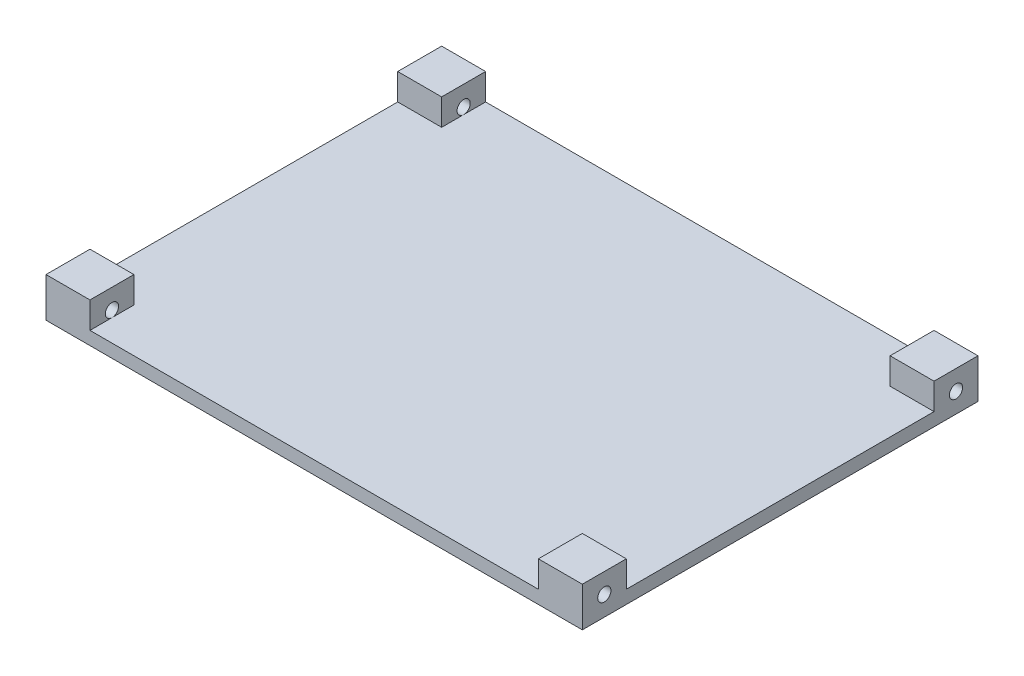
from build123d import *

# Parameters (mm, degrees)
SKETCH1_W           = 122
SKETCH1_H           = 90
BOSS_EXTRUDE1_DEPTH = 3
SKETCH2_W           = 10
SKETCH2_H           = 10
BOSS_EXTRUDE2_DEPTH = 6
CUT_EXTRUDE2_REACH  = 153.872
SKETCH4_R           = 1.5
CUT_EXTRUDE3_REACH  = 153.872
SKETCH5_R           = 1.5


with BuildPart() as part:
    # Sketch1 → Boss-Extrude1 (new body)
    with BuildSketch(Plane(origin=(0, 0, 0), x_dir=(1, 0, 0), z_dir=(0, 1, 0))):
        with Locations((61, 45)):
            Rectangle(SKETCH1_W, SKETCH1_H)
    extrude(amount=BOSS_EXTRUDE1_DEPTH)

    # Sketch2 → Boss-Extrude2 (add)
    with BuildSketch(Plane(origin=(0, 3, 0), x_dir=(1, 0, 0), z_dir=(0, 1, 0))):
        Polygon((0, 0), (10, 0), (10, 5.706645394), (10, 10), (7.781127404, 10), (0, 10), align=None)
        with Locations((5, 85)):
            Rectangle(SKETCH2_W, SKETCH2_H)
        with Locations((117, 85)):
            Rectangle(SKETCH2_W, SKETCH2_H)
        with Locations((117, 5)):
            Rectangle(SKETCH2_W, SKETCH2_H)
    extrude(amount=BOSS_EXTRUDE2_DEPTH)

    # Sketch4 → Cut-Extrude2 (cut, up to next)
    with BuildSketch(Plane.ZY, mode=Mode.PRIVATE) as cut_extrude2_sk1:
        with Locations((-85, 4.5)):
            Circle(SKETCH4_R)
    cut_extrude2_tool1 = extrude(cut_extrude2_sk1.sketch, amount=-CUT_EXTRUDE2_REACH, mode=Mode.PRIVATE) & part.part
    # Sketch4 → Cut-Extrude2 (cut, up to next)
    with BuildSketch(Plane.ZY, mode=Mode.PRIVATE) as cut_extrude2_sk2:
        with Locations((-5, 4.5)):
            Circle(SKETCH4_R)
    cut_extrude2_tool2 = extrude(cut_extrude2_sk2.sketch, amount=-CUT_EXTRUDE2_REACH, mode=Mode.PRIVATE) & part.part
    add(cut_extrude2_tool1.solids().sort_by_distance((0, 4.5, -85))[0], mode=Mode.SUBTRACT)
    add(cut_extrude2_tool2.solids().sort_by_distance((0, 4.5, -5))[0], mode=Mode.SUBTRACT)

    # Sketch5 → Cut-Extrude3 (cut, up to next)
    with BuildSketch(Plane(origin=(122, 0, 0), x_dir=(0, 0, -1), z_dir=(1, 0, 0)), mode=Mode.PRIVATE) as cut_extrude3_sk1:
        with Locations(Location((85, 4.5, 0), (0, 0, 180))):
            Circle(SKETCH5_R)
    cut_extrude3_tool1 = extrude(cut_extrude3_sk1.sketch, amount=-CUT_EXTRUDE3_REACH, mode=Mode.PRIVATE) & part.part
    # Sketch5 → Cut-Extrude3 (cut, up to next)
    with BuildSketch(Plane(origin=(122, 0, 0), x_dir=(0, 0, -1), z_dir=(1, 0, 0)), mode=Mode.PRIVATE) as cut_extrude3_sk2:
        with Locations(Location((5, 4.5, 0), (0, 0, 180))):
            Circle(SKETCH5_R)
    cut_extrude3_tool2 = extrude(cut_extrude3_sk2.sketch, amount=-CUT_EXTRUDE3_REACH, mode=Mode.PRIVATE) & part.part
    add(cut_extrude3_tool1.solids().sort_by_distance((122, 4.5, -85))[0], mode=Mode.SUBTRACT)
    add(cut_extrude3_tool2.solids().sort_by_distance((122, 4.5, -5))[0], mode=Mode.SUBTRACT)


solid = part.part
